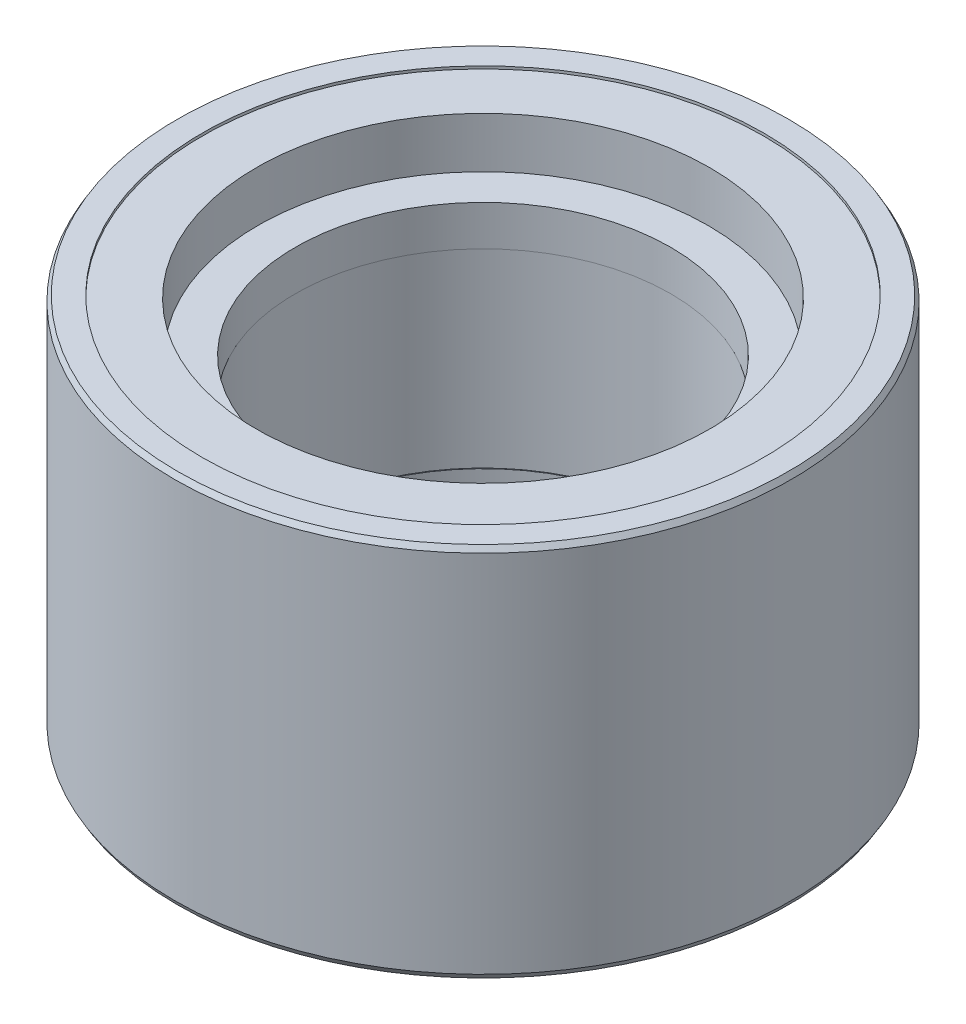
from build123d import *


with BuildPart() as part:
    # 草圖1 → 旋轉1 (revolve)
    with BuildSketch(Plane.XY, mode=Mode.PRIVATE) as revolve_1_sk:
        Polygon((70, 120.5), (70, 105.5), (70.3, 105.5), (70.3, 34.5), (70, 34.5), (70, 19.5), (84, 19.5), (84, 120.5), align=None)
    revolve(revolve_1_sk.sketch.rotate(Axis((0, 120.5, 0), (0, -1, 0)), 270), axis=Axis((0, 120.5, 0), (0, -1, 0)))


with BuildPart() as body_2:
    # 草圖2 → 旋轉2 (revolve)
    with BuildSketch(Plane.XY, mode=Mode.PRIVATE) as revolve_2_sk:
        Polygon((84.5, 139), (84.5, 1), (104.75, 1), (104.75, 0), (113.845299462, 0), (115, 2), (115, 138), (113.845299462, 140), (104.75, 140), (104.75, 139), align=None)
    revolve(revolve_2_sk.sketch.rotate(Axis((0, 0, 0), (0, 1, 0)), 90), axis=Axis((0, 0, 0), (0, 1, 0)))


solid = Compound([part.part, body_2.part])
